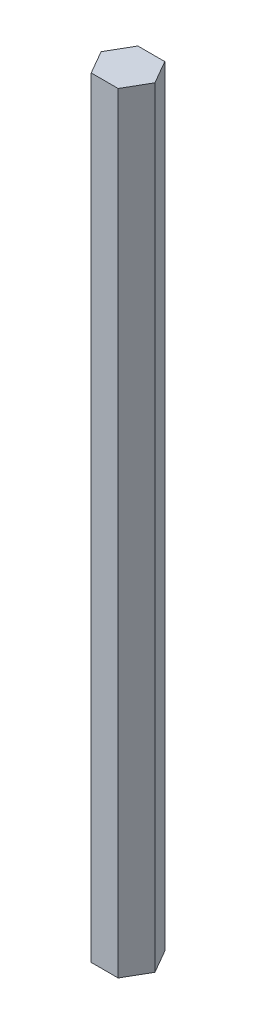
from build123d import *

# Parameters (mm, degrees)
BOSS_EXTRUDE1_DEPTH = 120


with BuildPart() as part:
    # Sketch1 → Boss-Extrude1 (new body)
    with BuildSketch(Plane(origin=(0, 0, 0), x_dir=(1, 0, 0), z_dir=(0, 1, 0))):
        Polygon((2.0975, 3.632976569), (-2.0975, 3.632976569), (-4.195, 0), (-2.0975, -3.632976569), (2.0975, -3.632976569), (4.195, 0), align=None)
    extrude(amount=-BOSS_EXTRUDE1_DEPTH)


solid = part.part
